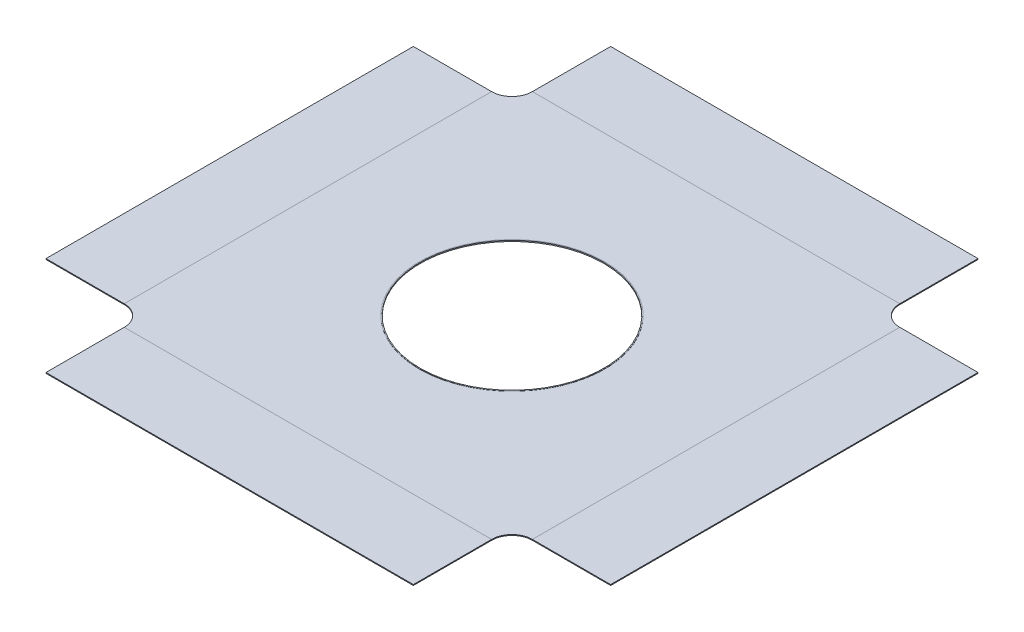
from build123d import *

# Parameters (mm, degrees)
SKETCH1_W           = 342.9
SKETCH1_H           = 342.9
BOSS_EXTRUDE1_DEPTH = 0.4064
SKETCH4_W           = 342.9
SKETCH4_H           = 0.8128
BOSS_EXTRUDE3_DEPTH = 92.075
CIRPATTERN1_COUNT   = 4
FILLET1_R           = 19.05
SKETCH7_R           = 85.725
CUT_EXTRUDE1_DEPTH  = 88.9
SKETCH7_3_R         = 86.58225
SKETCH7_3_R_2       = 85.725
BOSS_EXTRUDE4_DEPTH = 0.2032


with BuildPart() as part:
    # Sketch1 → Boss-Extrude1 (new, symmetric)
    with BuildSketch(Plane(origin=(0, 0, 0), x_dir=(1, 0, 0), z_dir=(0, 1, 0))):
        Rectangle(SKETCH1_W, SKETCH1_H)
    extrude(amount=BOSS_EXTRUDE1_DEPTH, both=True)

    # Sketch4 → Boss-Extrude3 (add)
    with BuildSketch(Plane.ZY.offset(171.45)):
        Rectangle(SKETCH4_W, SKETCH4_H)
    boss_extrude3 = extrude(amount=BOSS_EXTRUDE3_DEPTH)

    # CirPattern1: Boss-Extrude3 ×4 about axis
    cirpattern1_axis = Axis((0, 2.794, 0), (0, -1, 0))
    for i in range(1, CIRPATTERN1_COUNT):
        add(boss_extrude3.rotate(cirpattern1_axis, i * 360 / CIRPATTERN1_COUNT))

    # Fillet1
    fillet1_edges = [part.edges().sort_by_distance(p)[0] for p in [
        (-171.45, 0, -171.45),
        (-171.45, 0, 171.45),
        (171.45, 0, 171.45),
        (171.45, 0, -171.45),
    ]]
    fillet(fillet1_edges, radius=FILLET1_R)

    # Sketch7 → Cut-Extrude1 (cut)
    with BuildSketch(Plane(origin=(0, 0.4064, 0), x_dir=(1, 0, 0), z_dir=(0, 1, 0))):
        Circle(SKETCH7_R)
    extrude(amount=-CUT_EXTRUDE1_DEPTH, mode=Mode.SUBTRACT)

    # Sketch7<3> → Boss-Extrude4 (add, symmetric)
    with BuildSketch(Plane(origin=(0, 0.4064, 0), x_dir=(1, 0, 0), z_dir=(0, 1, 0))):
        Circle(SKETCH7_3_R)
        Circle(SKETCH7_3_R_2, mode=Mode.SUBTRACT)
    extrude(amount=BOSS_EXTRUDE4_DEPTH, both=True)


solid = part.part
